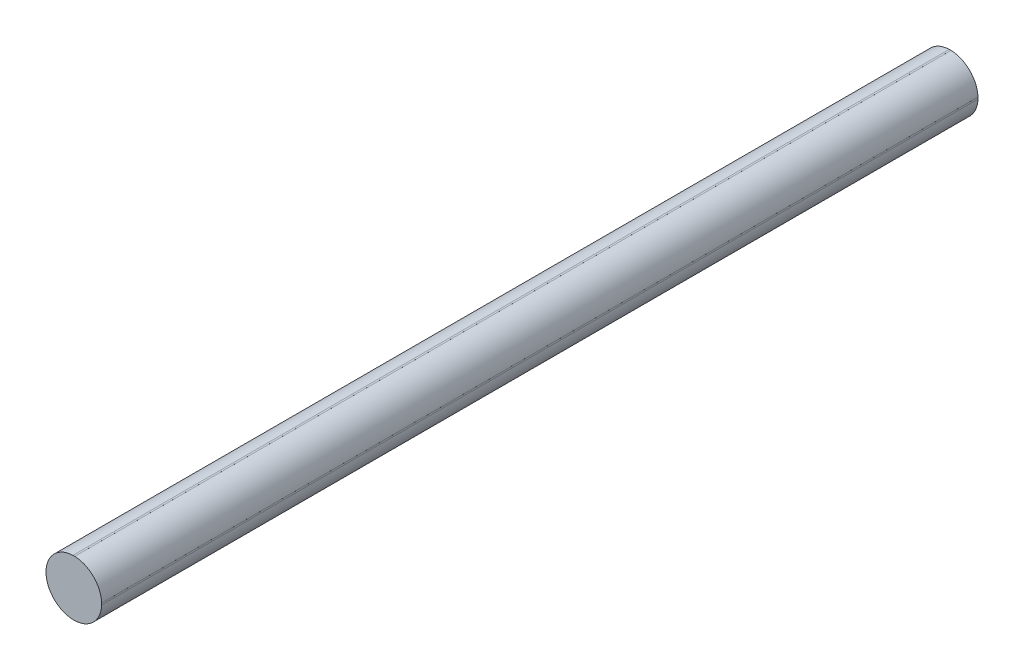
from build123d import *

# Parameters (mm, degrees)
CROQUIS1_R              = 31.75
SALIENTE_EXTRUIR1_DEPTH = 1000
SALIENTE_EXTRUIR2_DEPTH = 1000


with BuildPart() as part:
    # Croquis1 → Saliente-Extruir1 (new body)
    with BuildSketch(Plane.XY):
        Circle(CROQUIS1_R)
    extrude(amount=SALIENTE_EXTRUIR1_DEPTH)

    # Croquis2 → Saliente-Extruir2 (add)
    with BuildSketch(Plane.XY.offset(1000)):
        Polygon((31.75, 0), (31.75, -1), (30.75, -1), (30.75, 1), (31.75, 1), align=None)
        Polygon((-31.75, 1), (-31.75, 0), (-31.75, -1), (-30.75, -1), (-30.75, 1), align=None)
        Polygon((0, 31.75), (1, 31.75), (1, 30.75), (-1, 30.75), (-1, 31.75), align=None)
        Polygon((-1, -31.75), (0, -31.75), (1, -31.75), (1, -30.75), (-1, -30.75), align=None)
    extrude(amount=-SALIENTE_EXTRUIR2_DEPTH)


solid = part.part
